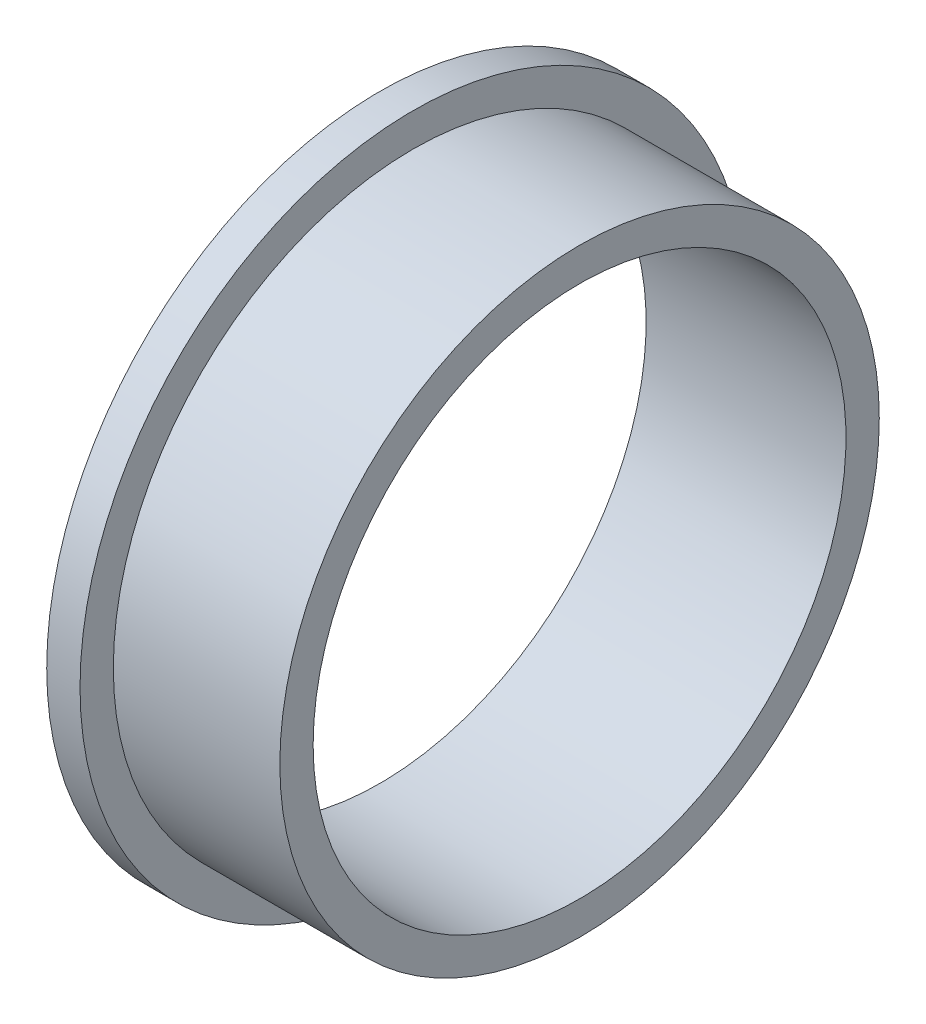
from build123d import *


with BuildPart() as part:
    # Sketch1 → Revolve1 (revolve)
    with BuildSketch(Plane(origin=(0, 0, 0), x_dir=(1, 0, 0), z_dir=(0, 1, 0)), mode=Mode.PRIVATE) as revolve1_sk:
        Polygon((-2, 16), (10, 16), (10, 18), (0, 18), (0, 20), (-2, 20), align=None)
    revolve(revolve1_sk.sketch.rotate(Axis((0, 0, 0), (1, 0, 0)), 180), axis=Axis((0, 0, 0), (1, 0, 0)))


solid = part.part
